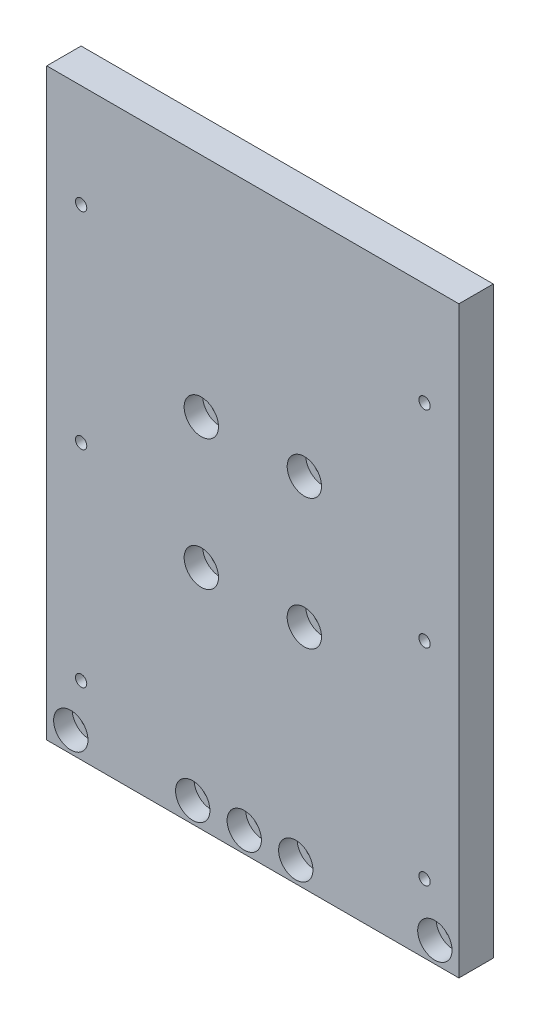
from build123d import *

# Parameters (mm, degrees)
SKETCH1_W                                           = 120
SKETCH1_H                                           = 170
BOSS_EXTRUDE1_DEPTH                                 = 5
M6_TAPPED_HOLE1_D                                   = 5
M6_TAPPED_HOLE1_DEPTH                               = 11.497848452
M6_TAPPED_HOLE1_TIP                                 = 1.502151548
CBORE_FOR_M5_HEX_SOCKET_HEAD_CAP_SCREW3_D           = 5.5
CBORE_FOR_M5_HEX_SOCKET_HEAD_CAP_SCREW3_DEPTH       = 20
CBORE_FOR_M5_HEX_SOCKET_HEAD_CAP_SCREW3_CBORE_D     = 10
CBORE_FOR_M5_HEX_SOCKET_HEAD_CAP_SCREW3_CBORE_DEPTH = 5.4
M4_TAPPED_HOLE1_D                                   = 3.3
CBORE_FOR_M5_HEX_SOCKET_HEAD_CAP_SCREW2_D           = 5.5
CBORE_FOR_M5_HEX_SOCKET_HEAD_CAP_SCREW2_CBORE_D     = 10
CBORE_FOR_M5_HEX_SOCKET_HEAD_CAP_SCREW2_CBORE_DEPTH = 5.4
CUT_EXTRUDE1_DEPTH                                  = 3


with BuildPart() as part:
    # Sketch1 → Boss-Extrude1 (new, symmetric)
    with BuildSketch(Plane.XY):
        Rectangle(SKETCH1_W, SKETCH1_H)
    extrude(amount=BOSS_EXTRUDE1_DEPTH, both=True)

    # M6 Tapped Hole1
    with Locations(Plane(origin=(0, -85, 0), x_dir=(-1, 0, 0), z_dir=(0, -1, 0))):
        with Locations((-42.5, -1), (-27.5, -1), (27.5, -1), (42.5, -1)):
            Hole(M6_TAPPED_HOLE1_D / 2, depth=M6_TAPPED_HOLE1_DEPTH)
            with Locations((0, 0, -(M6_TAPPED_HOLE1_DEPTH + M6_TAPPED_HOLE1_TIP / 2))):  # 118° drill point
                Cone(0, M6_TAPPED_HOLE1_D / 2, M6_TAPPED_HOLE1_TIP, mode=Mode.SUBTRACT)

    # CBORE for M5 Hex Socket Head Cap Screw3
    with Locations(Plane.XY.offset(5)):
        with Locations((53, -79), (12.5, -79), (-2.5, -79), (-17.5, -79), (-53, -79)):
            CounterBoreHole(CBORE_FOR_M5_HEX_SOCKET_HEAD_CAP_SCREW3_D / 2, CBORE_FOR_M5_HEX_SOCKET_HEAD_CAP_SCREW3_CBORE_D / 2, CBORE_FOR_M5_HEX_SOCKET_HEAD_CAP_SCREW3_CBORE_DEPTH, depth=CBORE_FOR_M5_HEX_SOCKET_HEAD_CAP_SCREW3_DEPTH)

    # M4 Tapped Hole1 (through all)
    with Locations(Plane(origin=(0, 0, -5), x_dir=(-1, 0, 0), z_dir=(0, 0, -1))):
        with Locations((50, -65), (50, -5), (50, 55), (-50, 55), (-50, -5), (-50, -65)):
            Hole(M4_TAPPED_HOLE1_D / 2)

    # CBORE for M5 Hex Socket Head Cap Screw2 (through all)
    with Locations(Plane.XY.offset(5)):
        with Locations((-15, 19), (15, 19), (15, -19), (-15, -19)):
            CounterBoreHole(CBORE_FOR_M5_HEX_SOCKET_HEAD_CAP_SCREW2_D / 2, CBORE_FOR_M5_HEX_SOCKET_HEAD_CAP_SCREW2_CBORE_D / 2, CBORE_FOR_M5_HEX_SOCKET_HEAD_CAP_SCREW2_CBORE_DEPTH)

    # Sketch35 → Cut-Extrude1 (cut)
    with BuildSketch(Plane(origin=(0, 0, -5), x_dir=(-1, 0, 0), z_dir=(0, 0, -1))):
        with BuildLine():
            Line((-23, 23.5), (23, 23.5))
            ThreePointArc((23, 23.5), (28.656854249, 21.156854249), (31, 15.5))
            Line((31, 15.5), (31, -15.5))
            ThreePointArc((31, -15.5), (28.656854249, -21.156854249), (23, -23.5))
            Line((23, -23.5), (-23, -23.5))
            ThreePointArc((-23, -23.5), (-28.656854249, -21.156854249), (-31, -15.5))
            Line((-31, -15.5), (-31, 15.5))
            ThreePointArc((-31, 15.5), (-28.656854249, 21.156854249), (-23, 23.5))
        make_face()
    extrude(amount=-CUT_EXTRUDE1_DEPTH, mode=Mode.SUBTRACT)


solid = part.part
